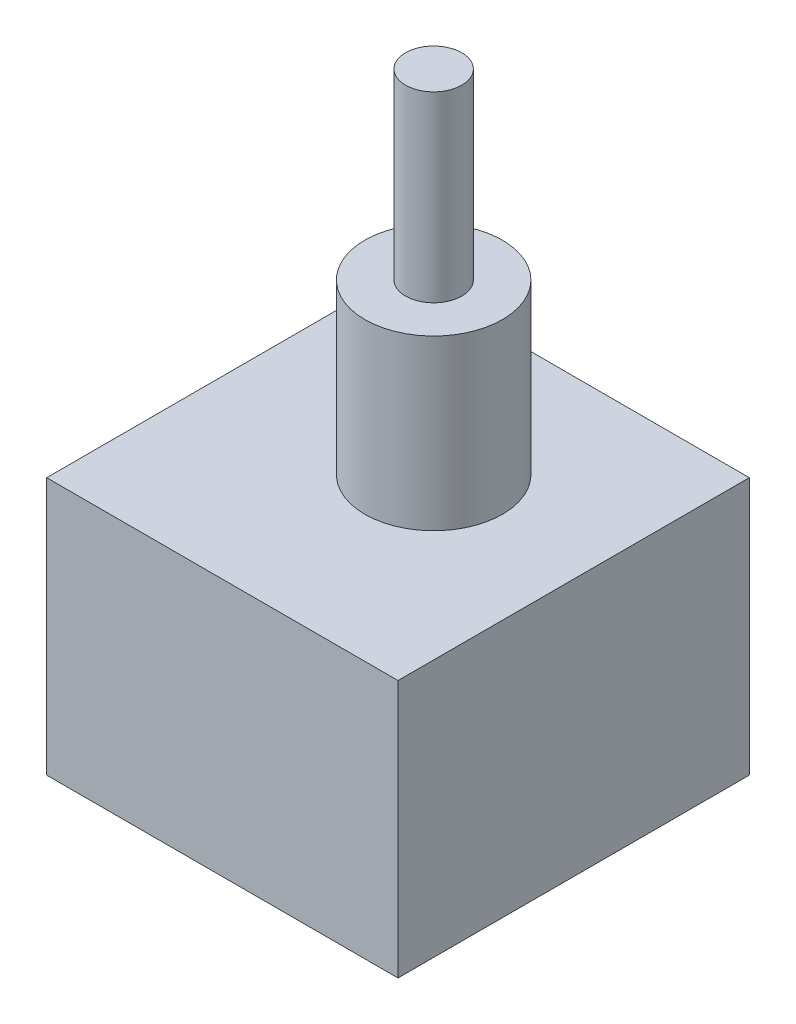
from build123d import *

# Parameters (mm, degrees)
SKETCH_1_W        = 30
SKETCH_1_H        = 30
EXTRUDE_268_DEPTH = 22
SKETCH_2_R        = 5.875
EXTRUDE_2_DEPTH   = 14.4
SKETCH_4_R        = 2.4
EXTRUDE_3_DEPTH   = 15.6


with BuildPart() as part:
    # Эскиз1 → Extrude 268 (new body)
    with BuildSketch(Plane(origin=(0, 0, 0), x_dir=(1, 0, 0), z_dir=(0, 1, 0))):
        with Locations((-1.294416244, -1.751269036)):
            Rectangle(SKETCH_1_W, SKETCH_1_H)
    extrude(amount=EXTRUDE_268_DEPTH)

    # Эскиз2 → Бобышка-Вытянуть2 (add)
    with BuildSketch(Plane(origin=(0, 22, 0), x_dir=(1, 0, 0), z_dir=(0, 1, 0))):
        with Locations(Location((0, 0, 0), (0, 0, 270))):
            Circle(SKETCH_2_R)
    extrude(amount=EXTRUDE_2_DEPTH)

    # Эскиз4 → Бобышка-Вытянуть3 (add)
    with BuildSketch(Plane(origin=(0, 36.4, 0), x_dir=(1, 0, 0), z_dir=(0, 1, 0))):
        with Locations(Location((0, 0, 0), (0, 0, 270))):
            Circle(SKETCH_4_R)
    extrude(amount=EXTRUDE_3_DEPTH)


solid = part.part
